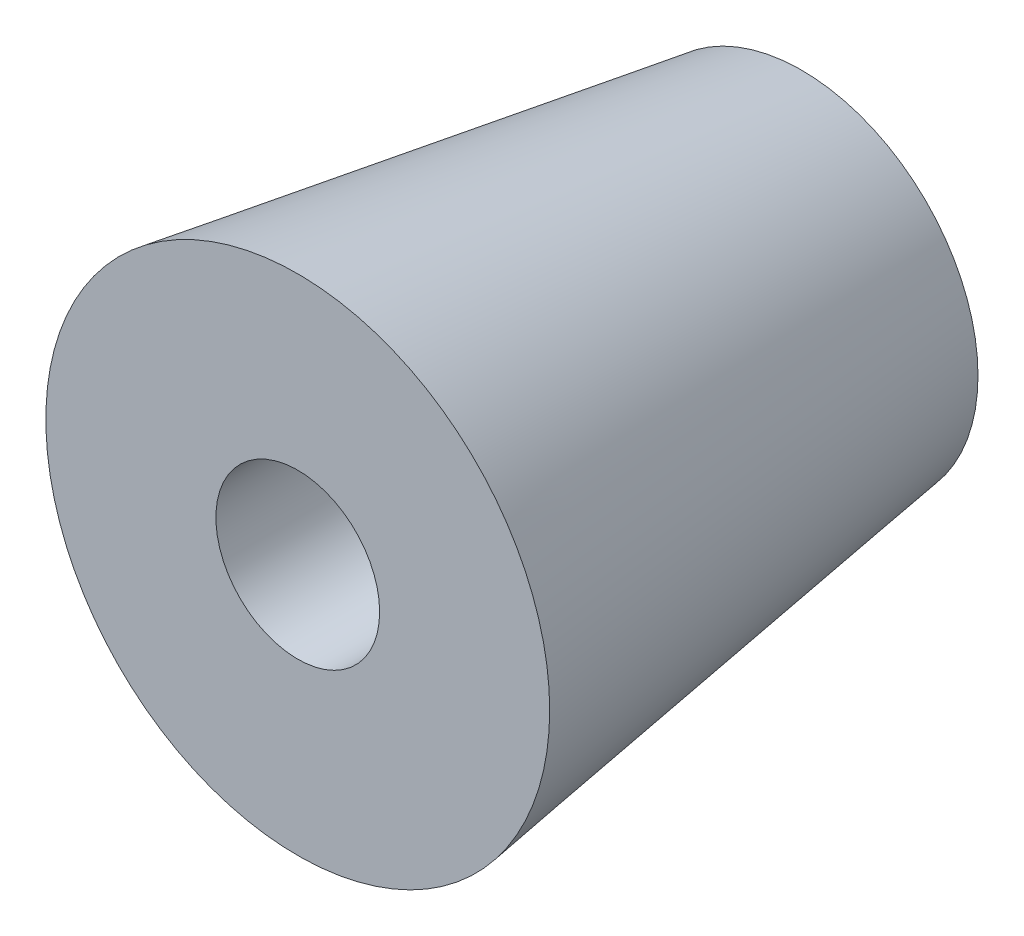
from build123d import *

# Parameters (mm, degrees)
SKETCH1_R           = 20
BOSS_EXTRUDE1_DEPTH = 40
BOSS_EXTRUDE1_DRAFT = -8.53
SKETCH2_R           = 6.5
CUT_EXTRUDE1_DEPTH  = 508.295068404


with BuildPart() as part:
    # Sketch1 → Boss-Extrude1 (with draft: the straight prism first)
    with BuildSketch(Plane.XY):
        with Locations((484.453522857, 15.706157787)):
            Circle(SKETCH1_R)
    extrude(amount=-BOSS_EXTRUDE1_DEPTH)
    # Boss-Extrude1: the draft: its side faces are tilted about the plane it starts from
    boss_extrude1_sides = [part.faces().sort_by_distance(p)[0] for p in [
        (464.453522857, 15.706157787, -20),
    ]]
    draft(boss_extrude1_sides, Plane.XY, BOSS_EXTRUDE1_DRAFT)

    # Sketch2 → Cut-Extrude1 (cut, through all)
    with BuildSketch(Plane.XY):
        with Locations((484.453522857, 15.706157787)):
            Circle(SKETCH2_R)
    extrude(amount=-CUT_EXTRUDE1_DEPTH, mode=Mode.SUBTRACT)


solid = part.part
